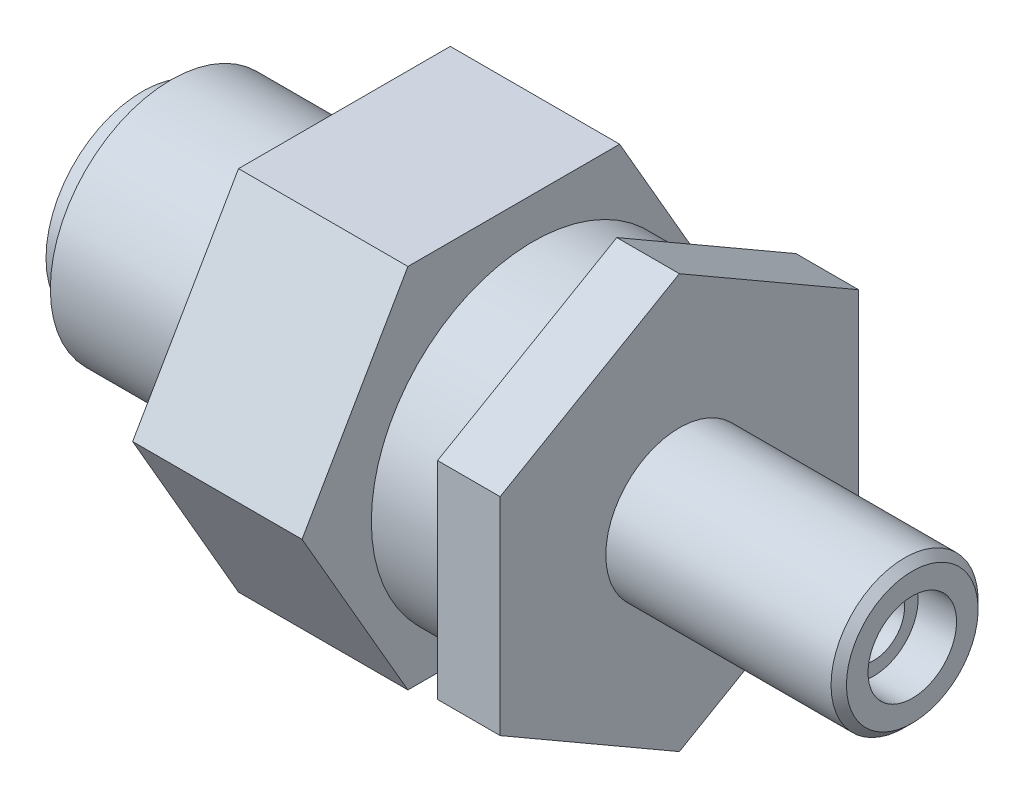
from build123d import *

# Parameters (mm, degrees)
CHAMFER1_SIZE  = 0.4
EXTRUDE1_START = -3.25
SKETCH2_R      = 11.925743973
EXTRUDE1_DEPTH = 3.25
EXTRUDE2_START = -8.8
SKETCH3_R      = 13.491172398
EXTRUDE2_DEPTH = 8.8


with BuildPart() as part:
    # Sketch1 → Revolve1 (revolve)
    with BuildSketch(Plane.XY, mode=Mode.PRIVATE) as revolve1_sk:
        Polygon((0, 0), (0, 5), (1.5, 5), (1.5, 6.275), (11, 6.275), (11, 8), (10.5, 8), (10.5, 11), (19.3, 11), (19.3, 6.5), (20.3, 6.5), (20.3, 8.4), (24.65, 8.4), (24.65, 10.75), (27.9, 10.75), (27.9, 3.82), (40, 3.82), (40, 2.3), (38, 2.3), (38, 1.6), (12, 1.6), (12, 0), align=None)
    revolve(revolve1_sk.sketch.rotate(Axis((0, 0, 0), (1, 0, 0)), 90), axis=Axis((0, 0, 0), (1, 0, 0)))

    # Chamfer1
    chamfer1_edges = [part.edges().sort_by_distance(p)[0] for p in [
        (40, 0, -3.82),
    ]]
    chamfer(chamfer1_edges, length=CHAMFER1_SIZE)

    # Sketch2 → Extrude1 (cut)
    with BuildSketch(Plane(origin=(27.9, 0, 0), x_dir=(0, 0, -1), z_dir=(1, 0, 0)).offset(EXTRUDE1_START)):
        Circle(SKETCH2_R)
        Polygon((0, 10.75), (-9.309773091, 5.375), (-9.309773091, -5.375), (0, -10.75), (9.309773091, -5.375), (9.309773091, 5.375), align=None, mode=Mode.SUBTRACT)
    extrude(amount=EXTRUDE1_DEPTH, mode=Mode.SUBTRACT)

    # Sketch3 → Extrude2 (cut)
    with BuildSketch(Plane(origin=(19.3, 0, 0), x_dir=(0, 0, -1), z_dir=(1, 0, 0)).offset(EXTRUDE2_START)):
        Circle(SKETCH3_R)
        Polygon((-5.5, 9.526279442), (-11, 0), (-5.5, -9.526279442), (5.5, -9.526279442), (11, 0), (5.5, 9.526279442), align=None, mode=Mode.SUBTRACT)
    extrude(amount=EXTRUDE2_DEPTH, mode=Mode.SUBTRACT)


solid = part.part
